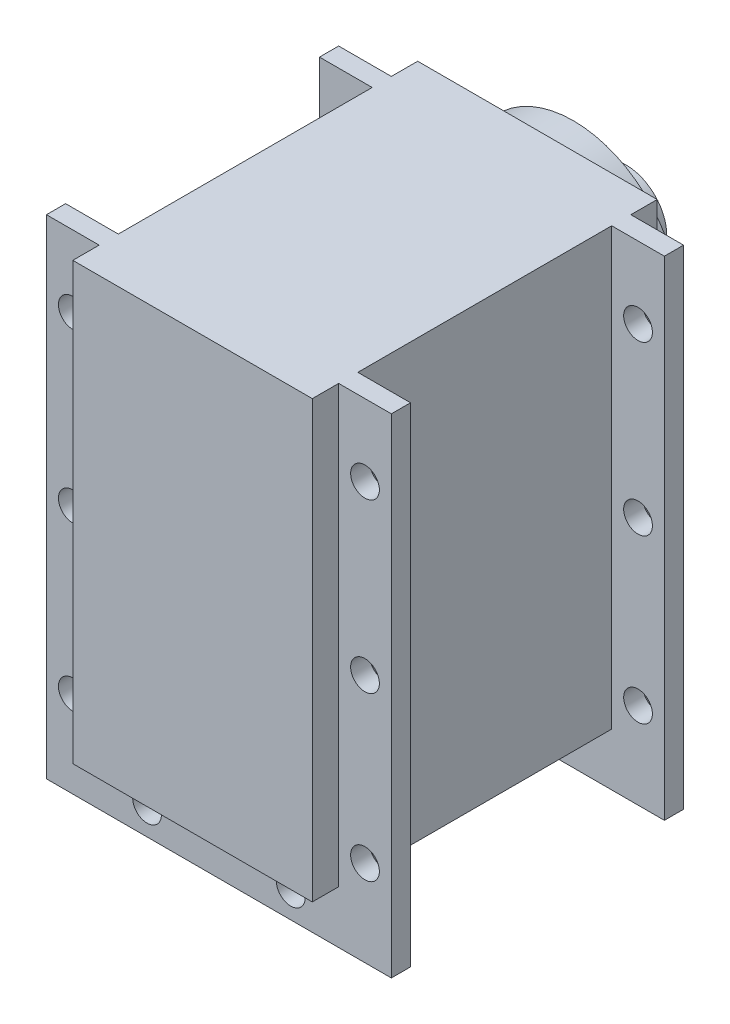
from build123d import *

# Parameters (mm, degrees)
SKETCH1_W           = 25
SKETCH1_H           = 45.5
BOSS_EXTRUDE1_DEPTH = 36
BOSS_EXTRUDE2_START = -2.75
SKETCH2_W           = 36
SKETCH2_H           = 51
SKETCH2_R           = 1.5
BOSS_EXTRUDE2_DEPTH = 2
SKETCH3_R           = 11
BOSS_EXTRUDE3_DEPTH = 3.75
SKETCH4_R           = 1.5
CUT_EXTRUDE1_DEPTH  = 3.75
SKETCH5_R           = 4.25
BOSS_EXTRUDE4_DEPTH = 5.5
BOSS_EXTRUDE5_START = -4.75
SKETCH6_W           = 36
SKETCH6_H           = 51
SKETCH6_R           = 1.5
BOSS_EXTRUDE5_DEPTH = 2


with BuildPart() as part:
    # Sketch1 → Boss-Extrude1 (new body)
    with BuildSketch(Plane.XY):
        Rectangle(SKETCH1_W, SKETCH1_H)
    extrude(amount=BOSS_EXTRUDE1_DEPTH)

    # Sketch2 → Boss-Extrude2 (add)
    with BuildSketch(Plane(origin=(0, 0, 0), x_dir=(-1, 0, 0), z_dir=(0, 0, -1)).offset(BOSS_EXTRUDE2_START)):
        with Locations((0, -2.75)):
            Rectangle(SKETCH2_W, SKETCH2_H)
        with Locations((-15.25, 15.25)):
            Circle(SKETCH2_R, mode=Mode.SUBTRACT)
        with Locations((-15.25, -2.25)):
            Circle(SKETCH2_R, mode=Mode.SUBTRACT)
        with Locations((-15.25, -19.25)):
            Circle(SKETCH2_R, mode=Mode.SUBTRACT)
        with Locations((-7.5, -25.5)):
            Circle(SKETCH2_R, mode=Mode.SUBTRACT)
        with Locations((7.5, -25.5)):
            Circle(SKETCH2_R, mode=Mode.SUBTRACT)
        with Locations((15.25, -19.25)):
            Circle(SKETCH2_R, mode=Mode.SUBTRACT)
        with Locations((15.25, -2.25)):
            Circle(SKETCH2_R, mode=Mode.SUBTRACT)
        with Locations((15.25, 15.25)):
            Circle(SKETCH2_R, mode=Mode.SUBTRACT)
    extrude(amount=-BOSS_EXTRUDE2_DEPTH)

    # Sketch3 → Boss-Extrude3 (add)
    with BuildSketch(Plane(origin=(0, 0, 0), x_dir=(-1, 0, 0), z_dir=(0, 0, -1))):
        with Locations((0, 10.75)):
            Circle(SKETCH3_R)
    extrude(amount=BOSS_EXTRUDE3_DEPTH)

    # Sketch4 → Cut-Extrude1 (cut)
    with BuildSketch(Plane(origin=(0, 0, -3.75), x_dir=(-1, 0, 0), z_dir=(0, 0, -1))):
        with Locations((0, 18.75)):
            Circle(SKETCH4_R)
        with Locations((-5.656854249, 16.406854249)):
            Circle(SKETCH4_R)
        with Locations((-8, 10.75)):
            Circle(SKETCH4_R)
        with Locations((-5.656854249, 5.093145751)):
            Circle(SKETCH4_R)
        with Locations((0, 2.75)):
            Circle(SKETCH4_R)
        with Locations((5.656854249, 5.093145751)):
            Circle(SKETCH4_R)
        with Locations((8, 10.75)):
            Circle(SKETCH4_R)
        with Locations((5.656854249, 16.406854249)):
            Circle(SKETCH4_R)
    extrude(amount=-CUT_EXTRUDE1_DEPTH, mode=Mode.SUBTRACT)

    # Sketch5 → Boss-Extrude4 (add)
    with BuildSketch(Plane(origin=(0, 0, -3.75), x_dir=(-1, 0, 0), z_dir=(0, 0, -1))):
        with Locations((0, 10.75)):
            Circle(SKETCH5_R)
    extrude(amount=BOSS_EXTRUDE4_DEPTH)

    # Sketch6 → Boss-Extrude5 (add)
    with BuildSketch(Plane.XY.offset(36).offset(BOSS_EXTRUDE5_START)):
        with Locations((0, -2.75)):
            Rectangle(SKETCH6_W, SKETCH6_H)
        with Locations(Location((-15.25, 15.25, 0), (0, 0, 180))):
            Circle(SKETCH6_R, mode=Mode.SUBTRACT)
        with Locations(Location((-15.25, -2.25, 0), (0, 0, 180))):
            Circle(SKETCH6_R, mode=Mode.SUBTRACT)
        with Locations(Location((-15.25, -19.25, 0), (0, 0, 180))):
            Circle(SKETCH6_R, mode=Mode.SUBTRACT)
        with Locations(Location((-7.5, -25.5, 0), (0, 0, 180))):
            Circle(SKETCH6_R, mode=Mode.SUBTRACT)
        with Locations(Location((7.5, -25.5, 0), (0, 0, 180))):
            Circle(SKETCH6_R, mode=Mode.SUBTRACT)
        with Locations(Location((15.25, -19.25, 0), (0, 0, 180))):
            Circle(SKETCH6_R, mode=Mode.SUBTRACT)
        with Locations(Location((15.25, -2.25, 0), (0, 0, 180))):
            Circle(SKETCH6_R, mode=Mode.SUBTRACT)
        with Locations(Location((15.25, 15.25, 0), (0, 0, 180))):
            Circle(SKETCH6_R, mode=Mode.SUBTRACT)
    extrude(amount=BOSS_EXTRUDE5_DEPTH)


solid = part.part
